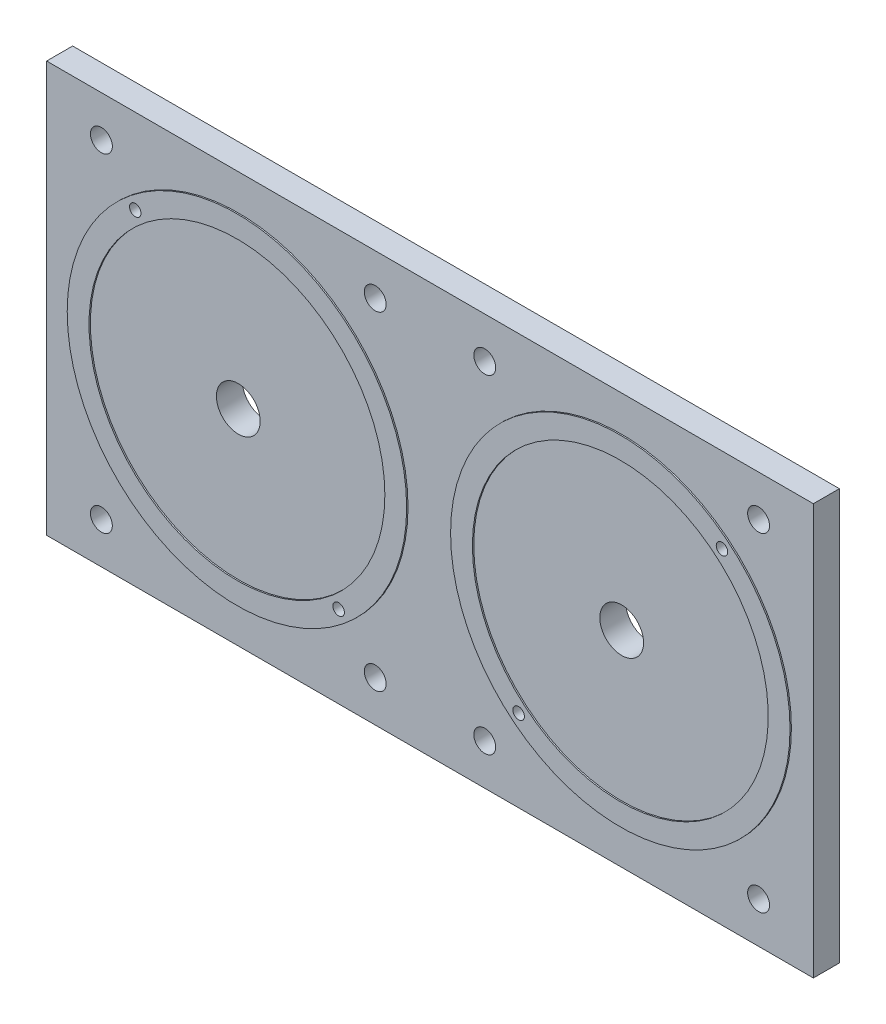
from build123d import *

# Parameters (mm, degrees)
ESQUISSE1_W                  = 140
ESQUISSE1_H                  = 75
BOSS_EXTRU_1_DEPTH           = 4.75
ESQUISSE2_R                  = 30.99
ESQUISSE2_R_2                = 27.01
BOSS_EXTRU_2_DEPTH           = 0.25
ENL_V_MAT_EXTRU_1_DEPTH      = 159.894815837
ENL_V_MAT_EXTRU_1_DEPTH_BACK = 159.894815837
ESQUISSE3_R                  = 2
ESQUISSE3_R_2                = 4
ESQUISSE3_R_3                = 1.05


with BuildPart() as part:
    # Esquisse1 → Boss.-Extru.1 (new body)
    with BuildSketch(Plane.XY):
        with Locations((70, 37.5)):
            Rectangle(ESQUISSE1_W, ESQUISSE1_H)
    extrude(amount=BOSS_EXTRU_1_DEPTH)

    # Esquisse2 → Boss.-Extru.2 (add)
    # profile 1 of 2: a face of its own
    with BuildSketch(Plane.XY.offset(4.75)):
        with Locations(Location((35, 37.5, 0), (0, 0, 180))):
            Circle(ESQUISSE2_R)
        with Locations((35, 37.5)):
            Circle(ESQUISSE2_R_2, mode=Mode.SUBTRACT)
    # profile 2 of 2: a face of its own
    with BuildSketch(Plane.XY.offset(4.75)):
        with Locations(Location((105, 37.5, 0), (0, 0, 180))):
            Circle(ESQUISSE2_R)
        with Locations(Location((105, 37.5, 0), (0, 0, 180))):
            Circle(ESQUISSE2_R_2, mode=Mode.SUBTRACT)
    extrude(amount=BOSS_EXTRU_2_DEPTH)

    # Esquisse3 → Enlèv. mat.-Extru.1 (cut, two sides: drawn at the far end of the back side and taken through both)
    with BuildSketch(Plane.XY.offset(4.75).offset(-ENL_V_MAT_EXTRU_1_DEPTH_BACK)):
        with Locations((10, 67.5)):
            Circle(ESQUISSE3_R)
        with Locations((60, 67.5)):
            Circle(ESQUISSE3_R)
        with Locations(Location((60, 7.5, 0), (0, 0, 180))):
            Circle(ESQUISSE3_R)
        with Locations(Location((10, 7.5, 0), (0, 0, 180))):
            Circle(ESQUISSE3_R)
        with Locations((130, 7.5)):
            Circle(ESQUISSE3_R)
        with Locations((80, 7.5)):
            Circle(ESQUISSE3_R)
        with Locations(Location((80, 67.5, 0), (0, 0, 180))):
            Circle(ESQUISSE3_R)
        with Locations(Location((130, 67.5, 0), (0, 0, 180))):
            Circle(ESQUISSE3_R)
        with Locations((35, 37.5)):
            Circle(ESQUISSE3_R_2)
        with Locations((105, 37.5)):
            Circle(ESQUISSE3_R_2)
        with Locations((16.43465241, 59.778417108)):
            Circle(ESQUISSE3_R_3)
        with Locations(Location((53.56534759, 15.221582892, 0), (0, 0, 180))):
            Circle(ESQUISSE3_R_3)
        with Locations(Location((123.56534759, 59.778417108, 0), (0, 0, 180))):
            Circle(ESQUISSE3_R_3)
        with Locations((86.43465241, 15.221582892)):
            Circle(ESQUISSE3_R_3)
    extrude(amount=ENL_V_MAT_EXTRU_1_DEPTH + ENL_V_MAT_EXTRU_1_DEPTH_BACK, mode=Mode.SUBTRACT)


solid = part.part
